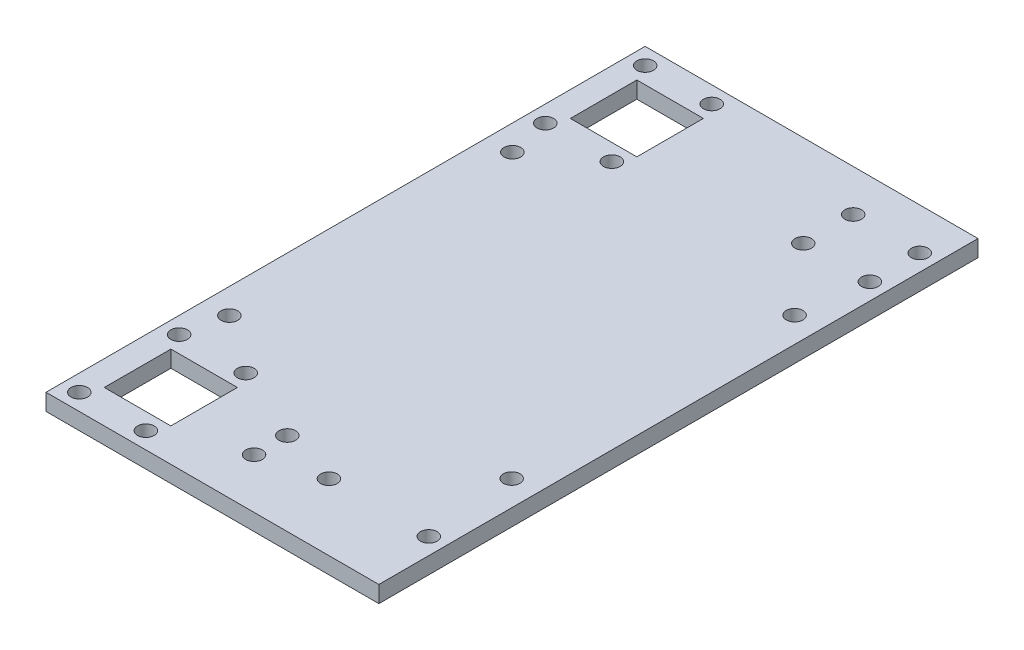
from build123d import *

# Parameters (mm, degrees)
SKETCH1_W           = 127
SKETCH1_H           = 228.6
SKETCH1_R           = 3.175
BOSS_EXTRUDE1_DEPTH = 6.35


with BuildPart() as part:
    # Sketch1 → Boss-Extrude1 (new body)
    with BuildSketch(Plane(origin=(0, 0, 0), x_dir=(1, 0, 0), z_dir=(0, 1, 0))):
        Rectangle(SKETCH1_W, SKETCH1_H)
        with Locations(Location((-57.15, 107.95, 0), (0, 0, 270))):
            Circle(SKETCH1_R, mode=Mode.SUBTRACT)
        with Locations(Location((-57.15, 69.85, 0), (0, 0, 270))):
            Circle(SKETCH1_R, mode=Mode.SUBTRACT)
        with Locations(Location((-31.75, 107.95, 0), (0, 0, 270))):
            Circle(SKETCH1_R, mode=Mode.SUBTRACT)
        with Locations(Location((-31.75, 69.85, 0), (0, 0, 270))):
            Circle(SKETCH1_R, mode=Mode.SUBTRACT)
        with Locations(Location((-31.75, -69.85, 0), (0, 0, 90))):
            Circle(SKETCH1_R, mode=Mode.SUBTRACT)
        with Locations(Location((-57.15, -69.85, 0), (0, 0, 90))):
            Circle(SKETCH1_R, mode=Mode.SUBTRACT)
        with Locations(Location((-31.75, -107.95, 0), (0, 0, 90))):
            Circle(SKETCH1_R, mode=Mode.SUBTRACT)
        with Locations(Location((-57.15, -107.95, 0), (0, 0, 90))):
            Circle(SKETCH1_R, mode=Mode.SUBTRACT)
        with Locations(Location((57.15, 98.425, 0), (0, 0, 270))):
            Circle(SKETCH1_R, mode=Mode.SUBTRACT)
        with Locations(Location((31.75, 98.425, 0), (0, 0, 270))):
            Circle(SKETCH1_R, mode=Mode.SUBTRACT)
        with Locations(Location((57.15, 79.375, 0), (0, 0, 270))):
            Circle(SKETCH1_R, mode=Mode.SUBTRACT)
        with Locations(Location((31.75, 79.375, 0), (0, 0, 270))):
            Circle(SKETCH1_R, mode=Mode.SUBTRACT)
        with Locations(Location((57.15, -88.9, 0), (0, 0, 270))):
            Circle(SKETCH1_R, mode=Mode.SUBTRACT)
        with Locations(Location((19.05, -88.9, 0), (0, 0, 270))):
            Circle(SKETCH1_R, mode=Mode.SUBTRACT)
        with Locations(Location((-53.848, -53.975, 0), (0, 0, 270))):
            Circle(SKETCH1_R, mode=Mode.SUBTRACT)
        with Locations(Location((-53.848, 53.975, 0), (0, 0, 90))):
            Circle(SKETCH1_R, mode=Mode.SUBTRACT)
        with Locations(Location((53.848, -53.975, 0), (0, 0, 90))):
            Circle(SKETCH1_R, mode=Mode.SUBTRACT)
        with Locations(Location((53.848, 53.975, 0), (0, 0, 270))):
            Circle(SKETCH1_R, mode=Mode.SUBTRACT)
        with Locations(Location((-3.175, -82.55, 0), (0, 0, 270))):
            Circle(SKETCH1_R, mode=Mode.SUBTRACT)
        with Locations(Location((-3.175, -95.25, 0), (0, 0, 270))):
            Circle(SKETCH1_R, mode=Mode.SUBTRACT)
        Polygon((-53.975, -101.599988436), (-53.940723216, -76.200011564), (-28.575, -76.200011564), (-28.575, -101.599988436), align=None, mode=Mode.SUBTRACT)
        Polygon((-53.975, 101.599988436), (-53.940723216, 76.200011564), (-28.575, 76.200011564), (-28.575, 101.599988436), align=None, mode=Mode.SUBTRACT)
    extrude(amount=BOSS_EXTRUDE1_DEPTH)


solid = part.part
